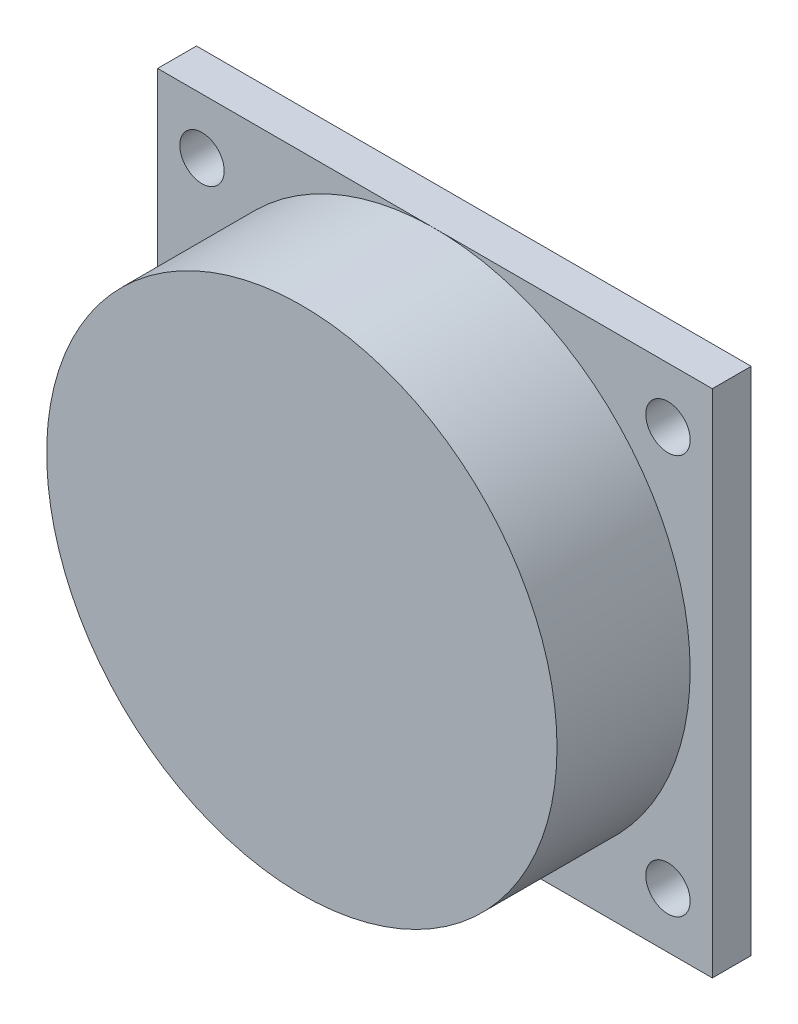
from build123d import *

# Parameters (mm, degrees)
SKETCH1_R                            = 11.5
SKETCH1_R_2                          = 10.25
BOSS_EXTRUDE1_DEPTH                  = 5.5
SKETCH2_R                            = 11.5
BOSS_EXTRUDE2_DEPTH                  = 0.5
SKETCH3_W                            = 25
SKETCH3_H                            = 23
SKETCH3_R                            = 10.25
BOSS_EXTRUDE3_DEPTH                  = 1.75
SKETCH4_W                            = 5.291507385
SKETCH4_H                            = 0.239377866
CUT_EXTRUDE1_DEPTH                   = 5
SKETCH5_W                            = 1
SKETCH5_H                            = 1.75
TAP_DRILL_FOR_M2X0_4_TAP1_AT_2_COUNT = 2
TAP_DRILL_FOR_M2X0_4_TAP1_AT_2_PITCH = 21
TAP_DRILL_FOR_M2X0_4_TAP1_AT_3_COUNT = 2
TAP_DRILL_FOR_M2X0_4_TAP1_AT_3_PITCH = 27.658633372
TAP_DRILL_FOR_M2X0_4_TAP1_AT_4_COUNT = 2
TAP_DRILL_FOR_M2X0_4_TAP1_AT_4_PITCH = 17.5


with BuildPart() as part:
    # Sketch1 → Boss-Extrude1 (new body)
    with BuildSketch(Plane.XY):
        Circle(SKETCH1_R)
        Circle(SKETCH1_R_2, mode=Mode.SUBTRACT)
    extrude(amount=BOSS_EXTRUDE1_DEPTH)

    # Sketch2 → Boss-Extrude2 (add)
    with BuildSketch(Plane.XY.offset(5.5)):
        Circle(SKETCH2_R)
    extrude(amount=BOSS_EXTRUDE2_DEPTH)


with BuildPart() as body_2:
    # Sketch3 → Boss-Extrude3 (new body)
    with BuildSketch(Plane(origin=(0, 0, 0), x_dir=(-1, 0, 0), z_dir=(0, 0, -1))):
        Rectangle(SKETCH3_W, SKETCH3_H)
        Circle(SKETCH3_R, mode=Mode.SUBTRACT)
    extrude(amount=BOSS_EXTRUDE3_DEPTH)

    # Sketch4 → Cut-Extrude1 (cut)
    with BuildSketch(Plane.XZ.offset(11.5)):
        with Locations((0.010767951, -1.630311067)):
            Rectangle(SKETCH4_W, SKETCH4_H)
    extrude(amount=-CUT_EXTRUDE1_DEPTH, mode=Mode.SUBTRACT)

    # Sketch5 → Tap Drill for M2x0.4 Tap1 (revolve, cut)
    with BuildSketch(Plane(origin=(-10.5, 9, 0), x_dir=(0, -1, 0), z_dir=(1, 0, 0))):
        with Locations((0.5, 0.875)):
            Rectangle(SKETCH5_W, SKETCH5_H)
    tap_drill_for_m2x0_4_tap1 = revolve(axis=Axis((-10.5, 9, 6.35), (0, 0, -1)), mode=Mode.SUBTRACT)

    # Tap Drill for M2x0.4 Tap1 at 2: Tap Drill for M2x0.4 Tap1 ×2
    with Locations(*[(i * TAP_DRILL_FOR_M2X0_4_TAP1_AT_2_PITCH, 0, 0) for i in range(1, TAP_DRILL_FOR_M2X0_4_TAP1_AT_2_COUNT)]):
        add(tap_drill_for_m2x0_4_tap1, mode=Mode.SUBTRACT)

    # Tap Drill for M2x0.4 Tap1 at 3: Tap Drill for M2x0.4 Tap1 ×2
    with Locations(*[Vector(0.7592566023652966, -0.6507913734559686, 0) * (i * TAP_DRILL_FOR_M2X0_4_TAP1_AT_3_PITCH) for i in range(1, TAP_DRILL_FOR_M2X0_4_TAP1_AT_3_COUNT)]):
        add(tap_drill_for_m2x0_4_tap1, mode=Mode.SUBTRACT)

    # Tap Drill for M2x0.4 Tap1 at 4: Tap Drill for M2x0.4 Tap1 ×2
    with Locations(*[(0, -i * TAP_DRILL_FOR_M2X0_4_TAP1_AT_4_PITCH, 0) for i in range(1, TAP_DRILL_FOR_M2X0_4_TAP1_AT_4_COUNT)]):
        add(tap_drill_for_m2x0_4_tap1, mode=Mode.SUBTRACT)


solid = Compound([part.part, body_2.part])
